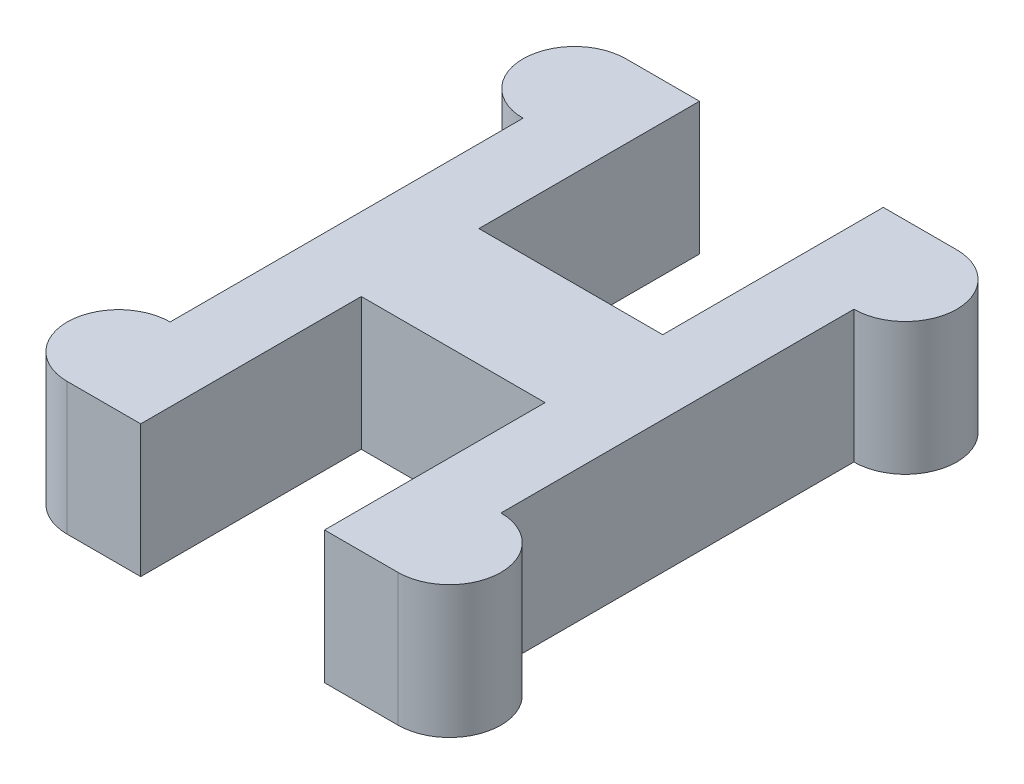
from build123d import *

# Parameters (mm, degrees)
SKETCH1_W           = 1
SKETCH1_H           = 1.4
BOSS_EXTRUDE1_DEPTH = 1.8


with BuildPart() as part:
    # Sketch1 → Boss-Extrude1 (new body)
    with BuildSketch(Plane(origin=(0, 0, 0), x_dir=(1, 0, 0), z_dir=(0, 1, 0))):
        Polygon((-2.25, 2.4), (-2.25, -2.4), (-1.25, -2.4), (-1.25, -0.8), (1.25, -0.8), (1.25, -2.4), (2.25, -2.4), (2.25, 2.4), (1.25, 2.4), (1.25, 0.8), (-1.25, 0.8), (-1.25, 2.4), align=None)
        with Locations((-1.75, 3.1)):
            Rectangle(SKETCH1_W, SKETCH1_H)
        with BuildLine():
            ThreePointArc((-2.25, 3.8), (-2.95, 3.1), (-2.25, 2.4))
            Line((-2.25, 2.4), (-2.25, 3.8))
        make_face()
        with Locations((1.75, 3.1)):
            Rectangle(SKETCH1_W, SKETCH1_H)
        with BuildLine():
            Line((2.25, 3.8), (2.25, 2.4))
            ThreePointArc((2.25, 2.4), (2.95, 3.1), (2.25, 3.8))
        make_face()
        with BuildLine():
            Line((2.25, -2.4), (2.25, -3.8))
            ThreePointArc((2.25, -3.8), (2.95, -3.1), (2.25, -2.4))
        make_face()
        with Locations((1.75, -3.1)):
            Rectangle(SKETCH1_W, SKETCH1_H)
        with Locations((-1.75, -3.1)):
            Rectangle(SKETCH1_W, SKETCH1_H)
        with BuildLine():
            ThreePointArc((-2.25, -2.4), (-2.95, -3.1), (-2.25, -3.8))
            Line((-2.25, -3.8), (-2.25, -2.4))
        make_face()
    extrude(amount=BOSS_EXTRUDE1_DEPTH)


solid = part.part
